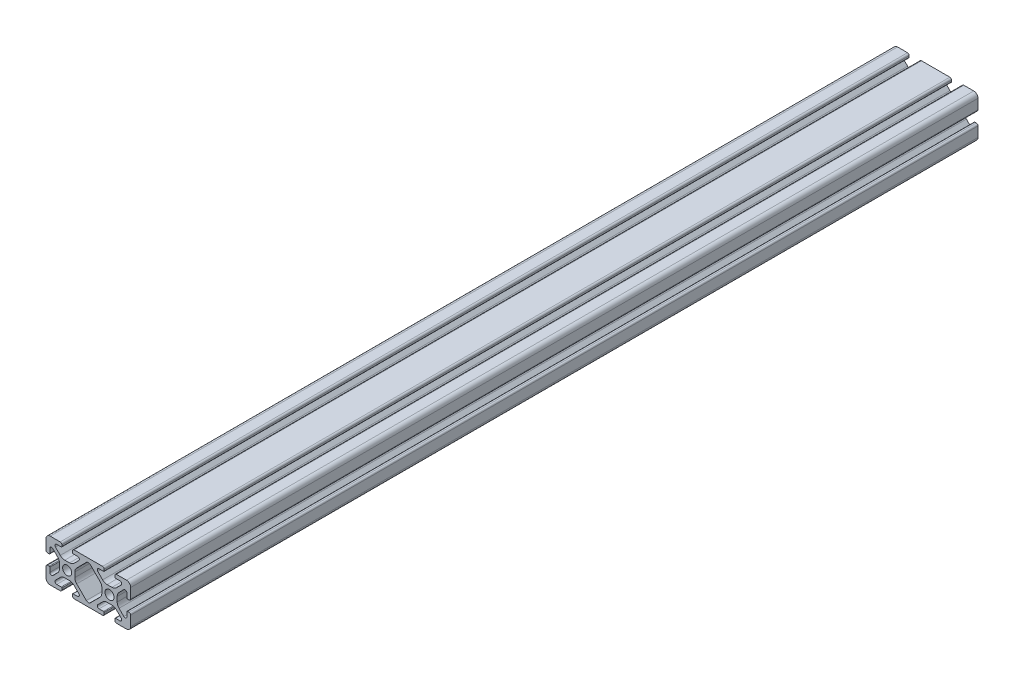
from build123d import *

# Parameters (mm, degrees)
SKETCH1_R           = 2.1463
BOSS_EXTRUDE1_DEPTH = 200


with BuildPart() as part:
    # Sketch1 → Boss-Extrude1 (new, symmetric)
    with BuildSketch(Plane.XY):
        with BuildLine():
            Line((-19.9898, 7.9883), (-19.9898, 3.2893))
            ThreePointArc((-19.9898, 3.2893), (-19.75917588, 2.73252412), (-19.2024, 2.5019))
            Line((-19.2024, 2.5019), (-18.4912, 2.5019))
            ThreePointArc((-18.4912, 2.5019), (-18.275673853, 2.591173853), (-18.1864, 2.8067))
            Line((-18.1864, 2.8067), (-18.1864, 4.9149))
            ThreePointArc((-18.1864, 4.9149), (-17.668965253, 5.689295824), (-16.755503096, 5.507596904))
            Line((-16.755503096, 5.507596904), (-14.500665747, 3.252759555))
            ThreePointArc((-14.500665747, 3.252759555), (-13.850954457, 2.280397894), (-13.622806192, 1.133419111))
            Line((-13.622806192, 1.133419111), (-13.622806192, -1.133419111))
            ThreePointArc((-13.622806192, -1.133419111), (-13.850954457, -2.280397894), (-14.500665747, -3.252759555))
            Line((-14.500665747, -3.252759555), (-16.755503096, -5.507596904))
            ThreePointArc((-16.755503096, -5.507596904), (-17.668965253, -5.689295824), (-18.1864, -4.9149))
            Line((-18.1864, -4.9149), (-18.1864, -2.8067))
            ThreePointArc((-18.1864, -2.8067), (-18.275673853, -2.591173853), (-18.4912, -2.5019))
            Line((-18.4912, -2.5019), (-19.2024, -2.5019))
            ThreePointArc((-19.2024, -2.5019), (-19.75917588, -2.73252412), (-19.9898, -3.2893))
            Line((-19.9898, -3.2893), (-19.9898, -7.9883))
            ThreePointArc((-19.9898, -7.9883), (-19.402080467, -9.407180467), (-17.9832, -9.9949))
            Line((-17.9832, -9.9949), (-13.2842, -9.9949))
            ThreePointArc((-13.2842, -9.9949), (-12.72742412, -9.76427588), (-12.4968, -9.2075))
            Line((-12.4968, -9.2075), (-12.4968, -8.4963))
            ThreePointArc((-12.4968, -8.4963), (-12.586073853, -8.280773853), (-12.8016, -8.1915))
            Line((-12.8016, -8.1915), (-14.9098, -8.1915))
            ThreePointArc((-14.9098, -8.1915), (-15.684195824, -7.674065253), (-15.502496904, -6.760603096))
            Line((-15.502496904, -6.760603096), (-13.247659555, -4.505765747))
            ThreePointArc((-13.247659555, -4.505765747), (-12.275297894, -3.856054457), (-11.128319111, -3.627906192))
            Line((-11.128319111, -3.627906192), (-8.861480889, -3.627906192))
            ThreePointArc((-8.861480889, -3.627906192), (-7.714502106, -3.856054457), (-6.742140445, -4.505765747))
            Line((-6.742140445, -4.505765747), (-4.487303096, -6.760603096))
            ThreePointArc((-4.487303096, -6.760603096), (-4.305604176, -7.674065253), (-5.08, -8.1915))
            Line((-5.08, -8.1915), (-7.1882, -8.1915))
            ThreePointArc((-7.1882, -8.1915), (-7.403726147, -8.280773853), (-7.493, -8.4963))
            Line((-7.493, -8.4963), (-7.493, -9.2075))
            ThreePointArc((-7.493, -9.2075), (-7.26237588, -9.76427588), (-6.7056, -9.9949))
            Line((-6.7056, -9.9949), (0, -9.9949))
            Line((0, -9.9949), (6.7056, -9.9949))
            ThreePointArc((6.7056, -9.9949), (7.26237588, -9.76427588), (7.493, -9.2075))
            Line((7.493, -9.2075), (7.493, -8.4963))
            ThreePointArc((7.493, -8.4963), (7.403726147, -8.280773853), (7.1882, -8.1915))
            Line((7.1882, -8.1915), (5.08, -8.1915))
            ThreePointArc((5.08, -8.1915), (4.305604176, -7.674065253), (4.487303096, -6.760603096))
            Line((4.487303096, -6.760603096), (6.742140445, -4.505765747))
            ThreePointArc((6.742140445, -4.505765747), (7.714502106, -3.856054457), (8.861480889, -3.627906192))
            Line((8.861480889, -3.627906192), (11.128319111, -3.627906192))
            ThreePointArc((11.128319111, -3.627906192), (12.275297894, -3.856054457), (13.247659555, -4.505765747))
            Line((13.247659555, -4.505765747), (15.502496904, -6.760603096))
            ThreePointArc((15.502496904, -6.760603096), (15.684195824, -7.674065253), (14.9098, -8.1915))
            Line((14.9098, -8.1915), (12.8016, -8.1915))
            ThreePointArc((12.8016, -8.1915), (12.586073853, -8.280773853), (12.4968, -8.4963))
            Line((12.4968, -8.4963), (12.4968, -9.2075))
            ThreePointArc((12.4968, -9.2075), (12.72742412, -9.76427588), (13.2842, -9.9949))
            Line((13.2842, -9.9949), (17.9832, -9.9949))
            ThreePointArc((17.9832, -9.9949), (19.402080467, -9.407180467), (19.9898, -7.9883))
            Line((19.9898, -7.9883), (19.9898, -3.2893))
            ThreePointArc((19.9898, -3.2893), (19.75917588, -2.73252412), (19.2024, -2.5019))
            Line((19.2024, -2.5019), (18.4912, -2.5019))
            ThreePointArc((18.4912, -2.5019), (18.275673853, -2.591173853), (18.1864, -2.8067))
            Line((18.1864, -2.8067), (18.1864, -4.9149))
            ThreePointArc((18.1864, -4.9149), (17.668965253, -5.689295824), (16.755503096, -5.507596904))
            Line((16.755503096, -5.507596904), (14.500665747, -3.252759555))
            ThreePointArc((14.500665747, -3.252759555), (13.850954457, -2.280397894), (13.622806192, -1.133419111))
            Line((13.622806192, -1.133419111), (13.622806192, 1.133419111))
            ThreePointArc((13.622806192, 1.133419111), (13.850954457, 2.280397894), (14.500665747, 3.252759555))
            Line((14.500665747, 3.252759555), (16.755503096, 5.507596904))
            ThreePointArc((16.755503096, 5.507596904), (17.668965253, 5.689295824), (18.1864, 4.9149))
            Line((18.1864, 4.9149), (18.1864, 2.8067))
            ThreePointArc((18.1864, 2.8067), (18.275673853, 2.591173853), (18.4912, 2.5019))
            Line((18.4912, 2.5019), (19.2024, 2.5019))
            ThreePointArc((19.2024, 2.5019), (19.75917588, 2.73252412), (19.9898, 3.2893))
            Line((19.9898, 3.2893), (19.9898, 7.9883))
            ThreePointArc((19.9898, 7.9883), (19.402080467, 9.407180467), (17.9832, 9.9949))
            Line((17.9832, 9.9949), (13.2842, 9.9949))
            ThreePointArc((13.2842, 9.9949), (12.72742412, 9.76427588), (12.4968, 9.2075))
            Line((12.4968, 9.2075), (12.4968, 8.4963))
            ThreePointArc((12.4968, 8.4963), (12.586073853, 8.280773853), (12.8016, 8.1915))
            Line((12.8016, 8.1915), (14.9098, 8.1915))
            ThreePointArc((14.9098, 8.1915), (15.684195824, 7.674065253), (15.502496904, 6.760603096))
            Line((15.502496904, 6.760603096), (13.247659555, 4.505765747))
            ThreePointArc((13.247659555, 4.505765747), (12.275297894, 3.856054457), (11.128319111, 3.627906192))
            Line((11.128319111, 3.627906192), (8.861480889, 3.627906192))
            ThreePointArc((8.861480889, 3.627906192), (7.714502106, 3.856054457), (6.742140445, 4.505765747))
            Line((6.742140445, 4.505765747), (4.487303096, 6.760603096))
            ThreePointArc((4.487303096, 6.760603096), (4.305604176, 7.674065253), (5.08, 8.1915))
            Line((5.08, 8.1915), (7.1882, 8.1915))
            ThreePointArc((7.1882, 8.1915), (7.403726147, 8.280773853), (7.493, 8.4963))
            Line((7.493, 8.4963), (7.493, 9.2075))
            ThreePointArc((7.493, 9.2075), (7.26237588, 9.76427588), (6.7056, 9.9949))
            Line((6.7056, 9.9949), (0, 9.9949))
            Line((0, 9.9949), (-6.7056, 9.9949))
            ThreePointArc((-6.7056, 9.9949), (-7.26237588, 9.76427588), (-7.493, 9.2075))
            Line((-7.493, 9.2075), (-7.493, 8.4963))
            ThreePointArc((-7.493, 8.4963), (-7.403726147, 8.280773853), (-7.1882, 8.1915))
            Line((-7.1882, 8.1915), (-5.08, 8.1915))
            ThreePointArc((-5.08, 8.1915), (-4.305604176, 7.674065253), (-4.487303096, 6.760603096))
            Line((-4.487303096, 6.760603096), (-6.742140445, 4.505765747))
            ThreePointArc((-6.742140445, 4.505765747), (-7.714502106, 3.856054457), (-8.861480889, 3.627906192))
            Line((-8.861480889, 3.627906192), (-11.128319111, 3.627906192))
            ThreePointArc((-11.128319111, 3.627906192), (-12.275297894, 3.856054457), (-13.247659555, 4.505765747))
            Line((-13.247659555, 4.505765747), (-15.502496904, 6.760603096))
            ThreePointArc((-15.502496904, 6.760603096), (-15.684195824, 7.674065253), (-14.9098, 8.1915))
            Line((-14.9098, 8.1915), (-12.8016, 8.1915))
            ThreePointArc((-12.8016, 8.1915), (-12.586073853, 8.280773853), (-12.4968, 8.4963))
            Line((-12.4968, 8.4963), (-12.4968, 9.2075))
            ThreePointArc((-12.4968, 9.2075), (-12.72742412, 9.76427588), (-13.2842, 9.9949))
            Line((-13.2842, 9.9949), (-17.9832, 9.9949))
            ThreePointArc((-17.9832, 9.9949), (-19.402080467, 9.407180467), (-19.9898, 7.9883))
        make_face()
        with Locations((-9.9949, 0)):
            Circle(SKETCH1_R, mode=Mode.SUBTRACT)
        with Locations(Location((9.9949, 0, 0), (0, 0, 180))):
            Circle(SKETCH1_R, mode=Mode.SUBTRACT)
        with BuildLine():
            Line((-6.366993808, 1.133419111), (-6.366993808, -1.133419111))
            ThreePointArc((-6.366993808, -1.133419111), (-6.138845543, -2.280397894), (-5.489134253, -3.252759555))
            Line((-5.489134253, -3.252759555), (-0.939581002, -7.802312806))
            ThreePointArc((-0.939581002, -7.802312806), (0, -8.1915), (0.939581002, -7.802312806))
            Line((0.939581002, -7.802312806), (5.489134253, -3.252759555))
            ThreePointArc((5.489134253, -3.252759555), (6.138845543, -2.280397894), (6.366993808, -1.133419111))
            Line((6.366993808, -1.133419111), (6.366993808, 1.133419111))
            ThreePointArc((6.366993808, 1.133419111), (6.138845543, 2.280397894), (5.489134253, 3.252759555))
            Line((5.489134253, 3.252759555), (0.939581002, 7.802312806))
            ThreePointArc((0.939581002, 7.802312806), (0, 8.1915), (-0.939581002, 7.802312806))
            Line((-0.939581002, 7.802312806), (-5.489134253, 3.252759555))
            ThreePointArc((-5.489134253, 3.252759555), (-6.138845543, 2.280397894), (-6.366993808, 1.133419111))
        make_face(mode=Mode.SUBTRACT)
    extrude(amount=BOSS_EXTRUDE1_DEPTH, both=True)


solid = part.part
